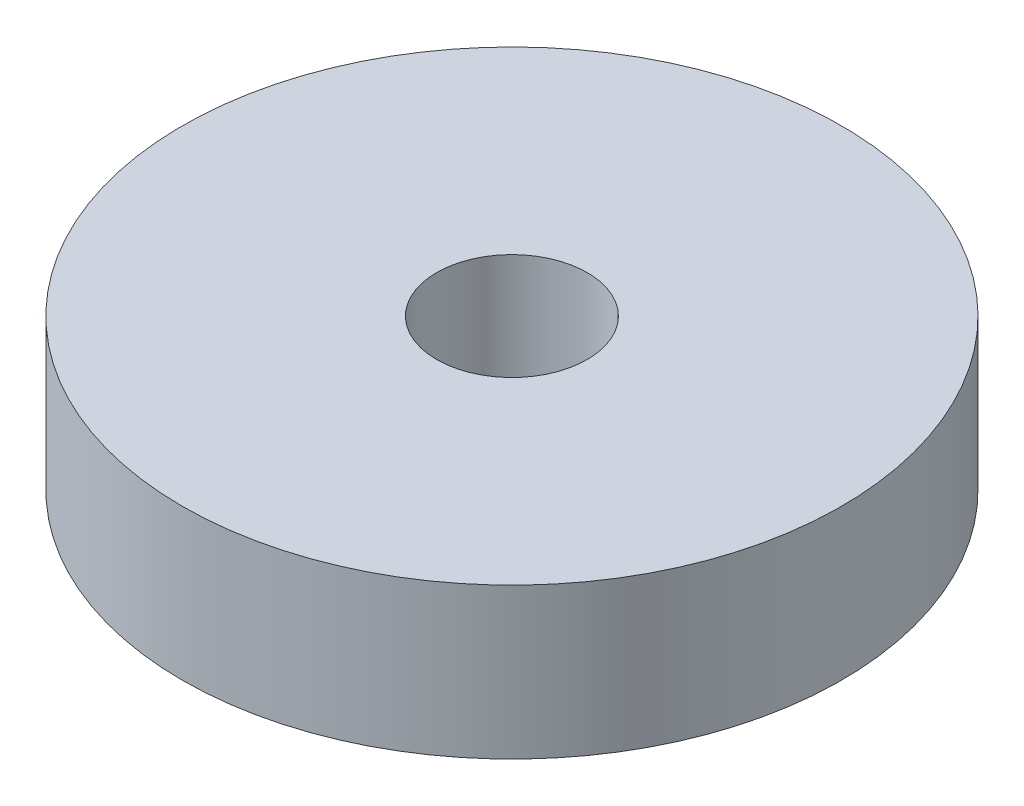
from build123d import *

# Parameters (mm, degrees)
SKETCH1_R           = 17.5
SKETCH1_R_2         = 4
BOSS_EXTRUDE1_DEPTH = 8


with BuildPart() as part:
    # Sketch1 → Boss-Extrude1 (new body)
    with BuildSketch(Plane(origin=(0, 0, 0), x_dir=(1, 0, 0), z_dir=(0, 1, 0))):
        with Locations(Location((0, 0, 0), (0, 0, 270))):
            Circle(SKETCH1_R)
        with Locations(Location((0, 0, 0), (0, 0, 270))):
            Circle(SKETCH1_R_2, mode=Mode.SUBTRACT)
    extrude(amount=BOSS_EXTRUDE1_DEPTH)


solid = part.part
